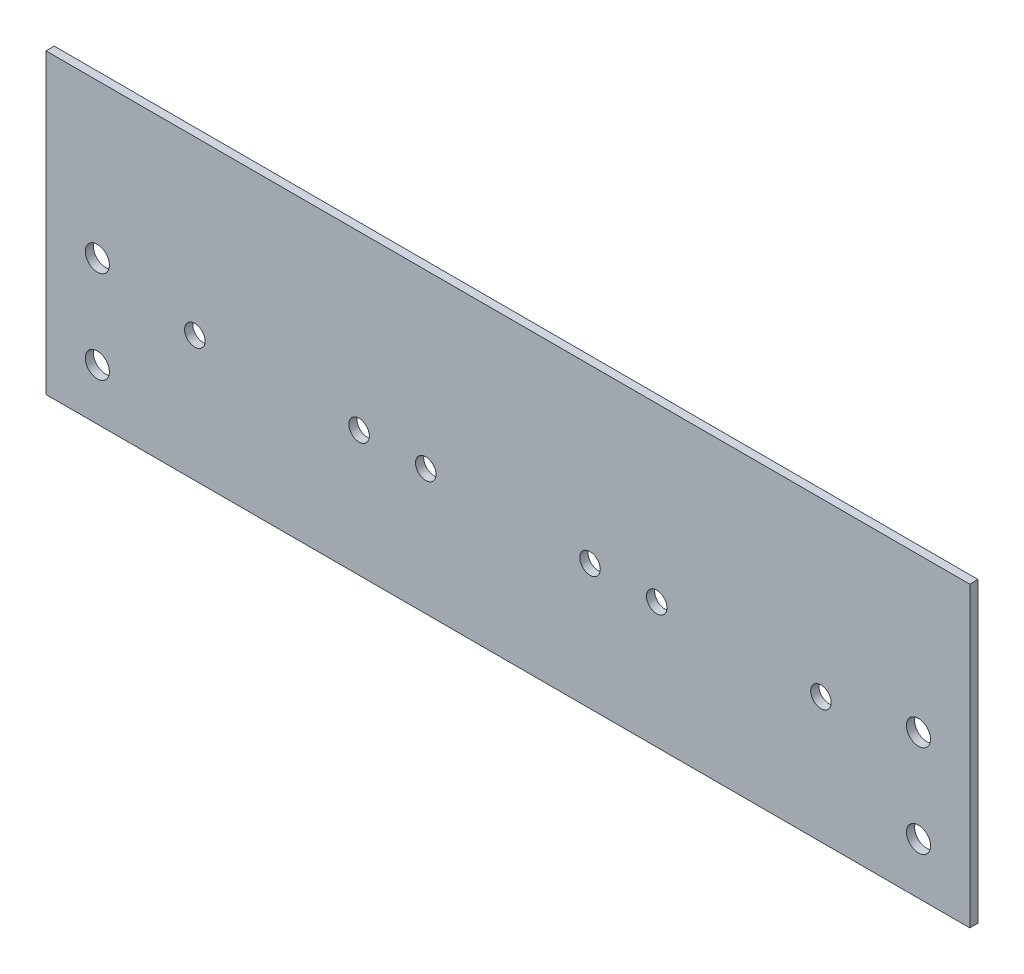
from build123d import *

# Parameters (mm, degrees)
SKETCH1_W           = 180
SKETCH1_H           = 58
SKETCH1_R           = 2.35
SKETCH1_R_2         = 2
BOSS_EXTRUDE1_DEPTH = 1.6


with BuildPart() as part:
    # Sketch1 → Boss-Extrude1 (new body)
    with BuildSketch(Plane.XY):
        with Locations((90, 29)):
            Rectangle(SKETCH1_W, SKETCH1_H)
        with Locations((10, 28)):
            Circle(SKETCH1_R, mode=Mode.SUBTRACT)
        with Locations((10, 10)):
            Circle(SKETCH1_R, mode=Mode.SUBTRACT)
        with Locations((29, 24.5)):
            Circle(SKETCH1_R_2, mode=Mode.SUBTRACT)
        with Locations((61, 24.5)):
            Circle(SKETCH1_R_2, mode=Mode.SUBTRACT)
        with Locations((74, 24.5)):
            Circle(SKETCH1_R_2, mode=Mode.SUBTRACT)
        with Locations((106, 24.5)):
            Circle(SKETCH1_R_2, mode=Mode.SUBTRACT)
        with Locations((119, 24.5)):
            Circle(SKETCH1_R_2, mode=Mode.SUBTRACT)
        with Locations((151, 24.5)):
            Circle(SKETCH1_R_2, mode=Mode.SUBTRACT)
        with Locations((170, 28)):
            Circle(SKETCH1_R, mode=Mode.SUBTRACT)
        with Locations((170, 10)):
            Circle(SKETCH1_R, mode=Mode.SUBTRACT)
    extrude(amount=BOSS_EXTRUDE1_DEPTH)


solid = part.part
